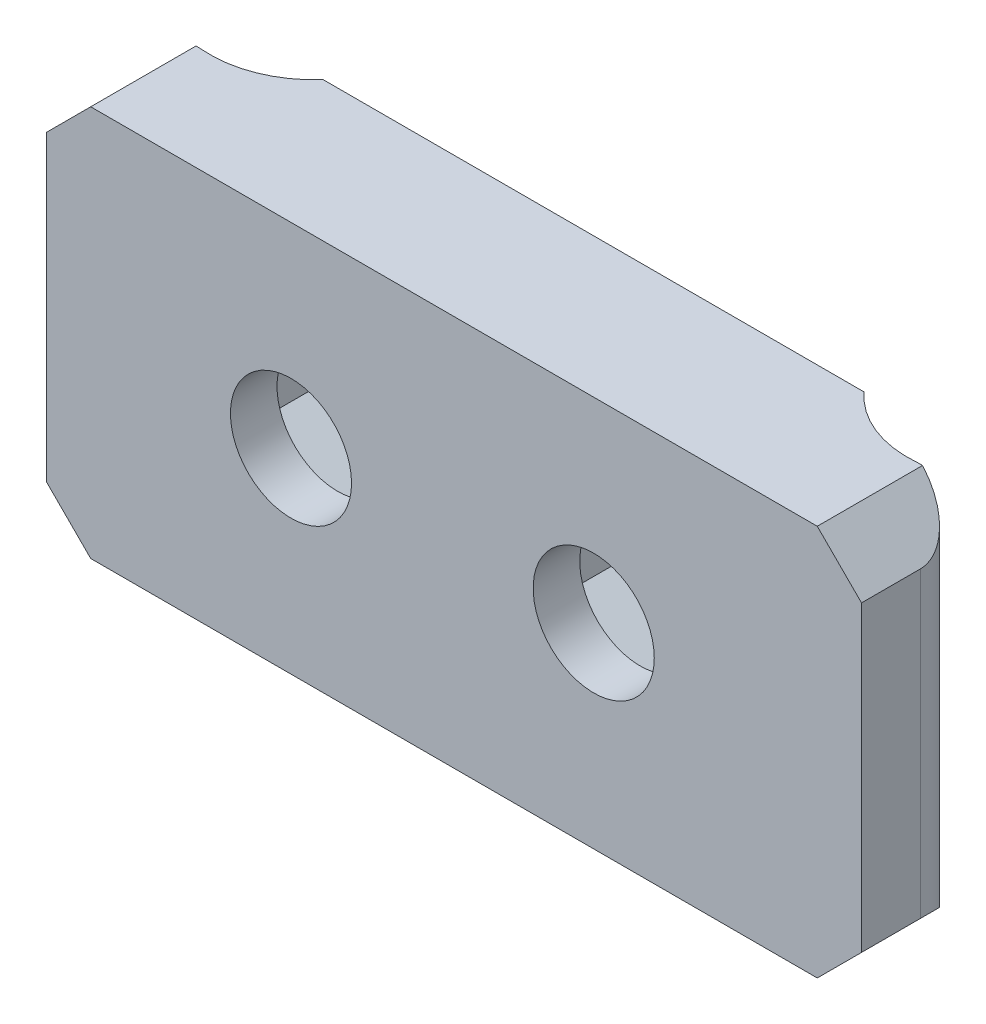
from build123d import *

# Parameters (mm, degrees)
SKETCH1_W           = 35
SKETCH1_H           = 21
BOSS_EXTRUDE1_DEPTH = 6
SKETCH2_W           = 35
SKETCH2_H           = 21
SKETCH2_R           = 2.6
BOSS_EXTRUDE2_DEPTH = 2
CHAMFER1_SIZE       = 4
CHAMFER2_SIZE       = 0.5
SKETCH3_R           = 4.499999999
SKETCH3_R_2         = 4.500000001
CUT_EXTRUDE1_DEPTH  = 49.5
FILLET1_R           = 2
FILLET2_R           = 2
SKETCH5_W           = 39.219322143
SKETCH5_H           = 6.192524549
SKETCH5_W_2         = 37.895134504
SKETCH5_H_2         = 8.100912618
CUT_EXTRUDE2_DEPTH  = 10


with BuildPart() as part:
    # Sketch1 → Boss-Extrude1 (new body)
    with BuildSketch(Plane(origin=(0, 0, 789.620141885), x_dir=(-1, 0, 0), z_dir=(0, 0, -1))):
        with Locations((-45.789156386, -208.298939869)):
            Rectangle(SKETCH1_W, SKETCH1_H)
        Polygon((-51.789156386, -203.564667662), (-55.889156386, -205.931803766), (-55.889156386, -210.666075973), (-51.789156386, -213.033212077), (-47.689156386, -210.666075973), (-47.689156386, -205.931803766), align=None, mode=Mode.SUBTRACT)
        Polygon((-42.889156386, -205.931803766), (-42.889156386, -210.666075973), (-38.789156386, -213.033212077), (-34.689156386, -210.666075973), (-34.689156386, -205.931803766), (-38.789156386, -203.564667662), align=None, mode=Mode.SUBTRACT)
    extrude(amount=BOSS_EXTRUDE1_DEPTH)

    # Sketch2 → Boss-Extrude2 (add)
    with BuildSketch(Plane.XY.offset(789.620141885)):
        with Locations((45.789156386, -208.298939869)):
            Rectangle(SKETCH2_W, SKETCH2_H)
        with Locations((38.789156386, -208.298939869)):
            Circle(SKETCH2_R, mode=Mode.SUBTRACT)
        with Locations((51.789156386, -208.298939869)):
            Circle(SKETCH2_R, mode=Mode.SUBTRACT)
    extrude(amount=-BOSS_EXTRUDE2_DEPTH)

    # Chamfer1
    chamfer1_edges = [part.edges().sort_by_distance(p)[0] for p in [
        (63.289156386, -197.798939869, 786.620141885),
        (28.289156386, -197.798939869, 786.620141885),
        (28.289156386, -218.798939869, 786.620141885),
        (63.289156386, -218.798939869, 786.620141885),
    ]]
    chamfer(chamfer1_edges, length=CHAMFER1_SIZE)

    # Chamfer2
    chamfer2_edges = [part.edges().sort_by_distance(p)[0] for p in [
        (45.789156386, -197.798939869, 783.620141885),
        (45.789156386, -218.798939869, 783.620141885),
        (28.289156386, -208.298939869, 783.620141885),
        (61.289156386, -216.798939869, 783.620141885),
        (30.289156386, -216.798939869, 783.620141885),
        (30.289156386, -199.798939869, 783.620141885),
        (61.289156386, -199.798939869, 783.620141885),
        (49.739156386, -204.748235714, 783.620141885),
        (53.839156386, -204.748235714, 783.620141885),
        (55.889156386, -208.298939869, 783.620141885),
        (53.839156386, -211.849644025, 783.620141885),
        (49.739156386, -211.849644025, 783.620141885),
        (47.689156386, -208.298939869, 783.620141885),
        (40.839156386, -204.748235714, 783.620141885),
        (42.889156386, -208.298939869, 783.620141885),
        (40.839156386, -211.849644025, 783.620141885),
        (36.739156386, -211.849644025, 783.620141885),
        (34.689156386, -208.298939869, 783.620141885),
        (36.739156386, -204.748235714, 783.620141885),
        (63.289156386, -208.298939869, 783.620141885),
    ]]
    chamfer(chamfer2_edges, length=CHAMFER2_SIZE)

    # Sketch3 → Cut-Extrude1 (cut)
    with BuildSketch(Plane(origin=(0, -197.798939869, 0), x_dir=(1, 0, 0), z_dir=(0, 1, 0))):
        with Locations((30.822197264, -780.620141885)):
            Circle(SKETCH3_R)
        with Locations((60.756115509, -780.620141885)):
            Circle(SKETCH3_R_2)
    extrude(amount=-CUT_EXTRUDE1_DEPTH, mode=Mode.SUBTRACT)

    # Fillet1
    fillet1_edges = [part.edges().sort_by_distance(p)[0] for p in [
        (28.289156386, -208.298939869, 784.339510636),
    ]]
    fillet(fillet1_edges, radius=FILLET1_R)

    # Fillet2
    fillet2_edges = [part.edges().sort_by_distance(p)[0] for p in [
        (63.289156386, -208.298939869, 784.339510637),
    ]]
    fillet(fillet2_edges, radius=FILLET2_R)

    # Sketch5 → Cut-Extrude2 (cut)
    with BuildSketch(Plane(origin=(0, 0, 783.620141885), x_dir=(-1, 0, 0), z_dir=(0, 0, -1))):
        with Locations((-46.0812566, -196.802677595)):
            Rectangle(SKETCH5_W, SKETCH5_H)
        with Locations((-45.419162781, -220.749396178)):
            Rectangle(SKETCH5_W_2, SKETCH5_H_2)
    extrude(amount=-CUT_EXTRUDE2_DEPTH, mode=Mode.SUBTRACT)


solid = part.part
